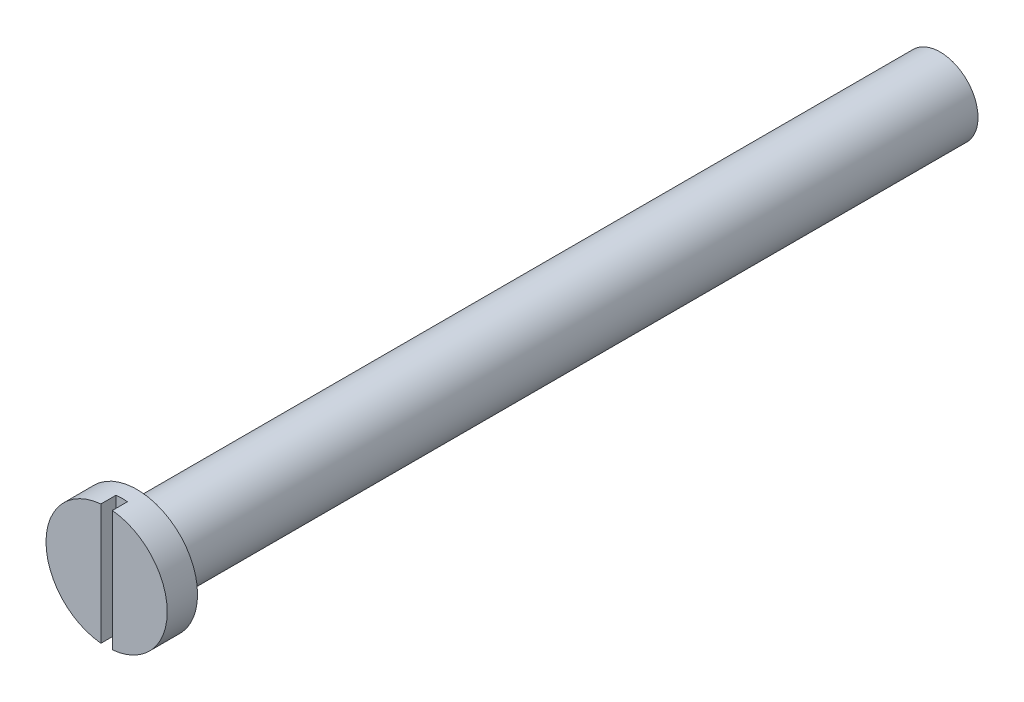
from build123d import *

# Parameters (mm, degrees)
SKETCH_1_R             = 5
EXTRUDE_1_DEPTH        = 106
SKETCH_2_R             = 8
EXTRUDE_2_DEPTH        = 4
SKETCH_4_W             = 1.5
SKETCH_4_H             = 19.56005024
CUT_EXTRUDE_1_DEPTH    = 2
HOLE_WIZARD_M8_1_D     = 6.8
HOLE_WIZARD_M8_1_DEPTH = 15
HOLE_WIZARD_M8_1_TIP   = 2.042926105


with BuildPart() as part:
    # 草图1 → 凸台-拉伸1 (new body)
    with BuildSketch(Plane.XY):
        Circle(SKETCH_1_R)
    extrude(amount=EXTRUDE_1_DEPTH)

    # 草图2 → 凸台-拉伸2 (add)
    with BuildSketch(Plane.XY.offset(106)):
        Circle(SKETCH_2_R)
    extrude(amount=EXTRUDE_2_DEPTH)

    # 草图4 → 切除-拉伸1 (cut)
    with BuildSketch(Plane.XY.offset(110)):
        Rectangle(SKETCH_4_W, SKETCH_4_H)
    extrude(amount=-CUT_EXTRUDE_1_DEPTH, mode=Mode.SUBTRACT)

    # M8 螺纹孔的螺纹孔钻头1
    with Locations(Plane(origin=(0, 0, 0), x_dir=(-1, 0, 0), z_dir=(0, 0, -1))):
        with Locations((0, 0)):
            Hole(HOLE_WIZARD_M8_1_D / 2, depth=HOLE_WIZARD_M8_1_DEPTH)
            with Locations((0, 0, -(HOLE_WIZARD_M8_1_DEPTH + HOLE_WIZARD_M8_1_TIP / 2))):  # 118° drill point
                Cone(0, HOLE_WIZARD_M8_1_D / 2, HOLE_WIZARD_M8_1_TIP, mode=Mode.SUBTRACT)


solid = part.part
